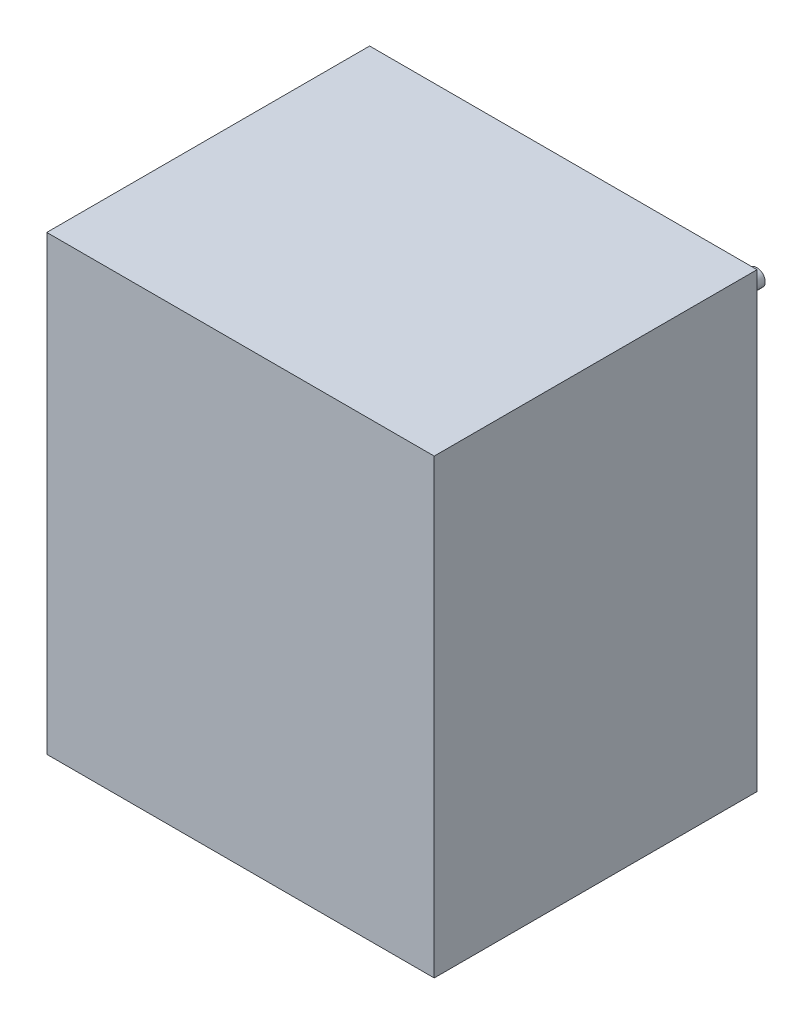
from build123d import *

# Parameters (mm, degrees)
CROQUIS1_W              = 600
CROQUIS1_H              = 700
SALIENTE_EXTRUIR1_DEPTH = 500
CROQUIS2_R              = 12.7
SALIENTE_EXTRUIR2_DEPTH = 10
CROQUIS3_R              = 12.7


with BuildPart() as part:
    # Croquis1 → Saliente-Extruir1 (new body)
    with BuildSketch(Plane.XY):
        with Locations((300, 350)):
            Rectangle(CROQUIS1_W, CROQUIS1_H)
    extrude(amount=SALIENTE_EXTRUIR1_DEPTH)

    # Croquis2 → Saliente-Extruir2 (add)
    with BuildSketch(Plane.ZY):
        with Locations(Location((40, 30, 0), (0, 0, 180))):
            Circle(CROQUIS2_R)
    extrude(amount=SALIENTE_EXTRUIR2_DEPTH)

    # Barrer1: sweep along a curve in space
    with BuildLine() as barrer1_path:
        Line((-10, 30, 40), (-40, 30, 40))
        ThreePointArc((-40, 30, 40), (-54.142135624, 30, 34.142135624), (-60, 30, 20))
        Line((-60, 30, 20), (-60, 30, -660))
    # Croquis3 → Barrer1 (sweep)
    with BuildSketch(Plane.ZY.offset(10)):
        with Locations((40, 30)):
            Circle(CROQUIS3_R)
    sweep(path=barrer1_path.line)


solid = part.part
